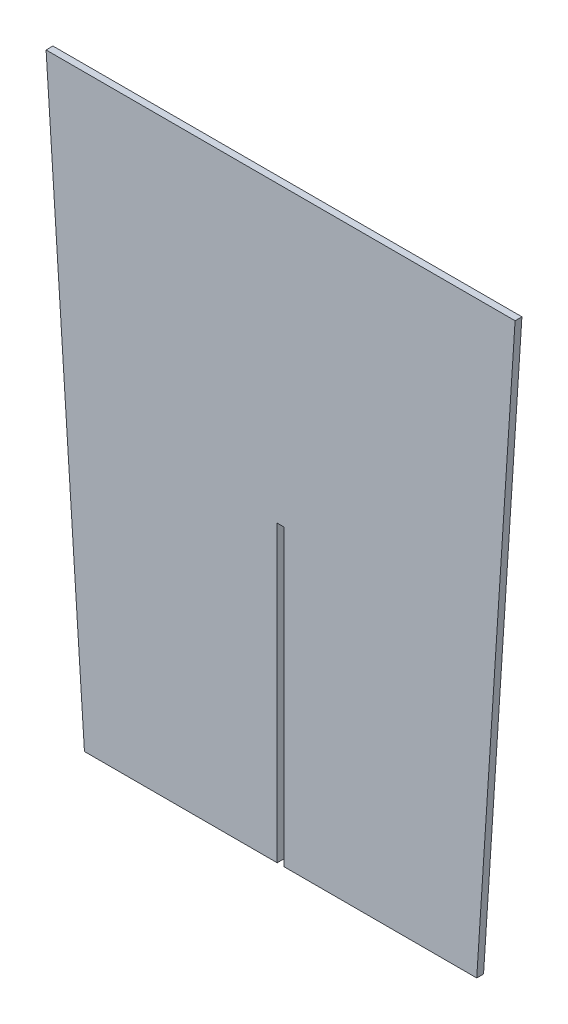
from build123d import *

# Parameters (mm, degrees)
BOSS_EXTRUDE1_DEPTH = 4


with BuildPart() as part:
    # Sketch4 → Boss-Extrude1 (new body)
    with BuildSketch(Plane.XY):
        Polygon((-22.5, 345), (0, 0), (113, 0), (113, 172.5), (117, 172.5), (117, 0), (230, 0), (252.5, 345), align=None)
    extrude(amount=BOSS_EXTRUDE1_DEPTH)


solid = part.part
